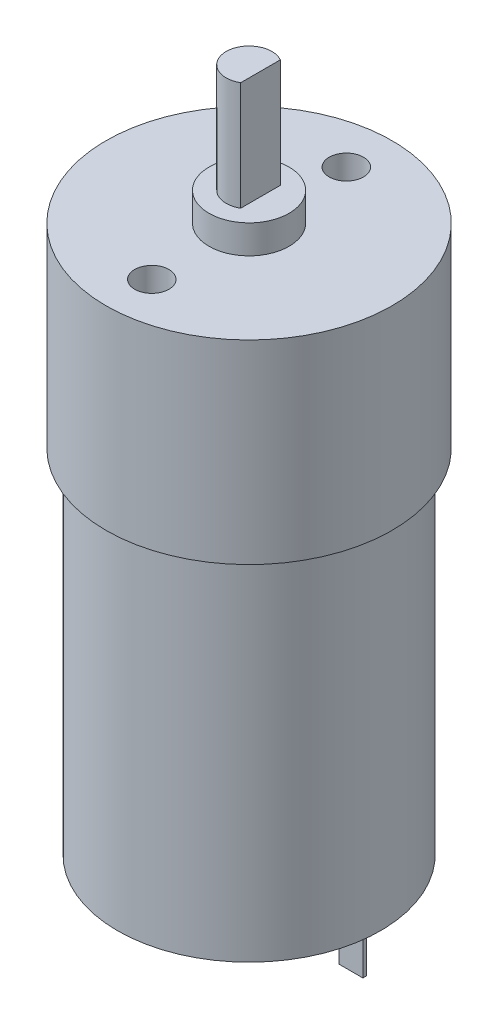
from build123d import *

# Parameters (mm, degrees)
SKETCH2_R           = 12.5
SKETCH2_R_2         = 2
SKETCH2_R_3         = 3.5
BOSS_EXTRUDE1_DEPTH = 17
SKETCH2_3_R         = 2
BOSS_EXTRUDE2_DEPTH = 12
SKETCH2_4_R         = 3.5
SKETCH2_4_R_2       = 2
BOSS_EXTRUDE3_DEPTH = 2.5
SKETCH4_R           = 11.5
BOSS_EXTRUDE4_DEPTH = 30.8
SKETCH5_W           = 2.1
SKETCH5_H           = 0.3
BOSS_EXTRUDE5_DEPTH = 4.2
SKETCH6_R           = 1.5
CUT_EXTRUDE1_DEPTH  = 5
CUT_EXTRUDE2_START  = -9.5
CUT_EXTRUDE2_DEPTH  = 9.5


with BuildPart() as part:
    # Sketch2 → Boss-Extrude1 (new body)
    # profile 1 of 3: a face of its own
    with BuildSketch(Plane(origin=(0, 0, 0), x_dir=(1, 0, 0), z_dir=(0, 1, 0))):
        with Locations(Location((0, 0, 0), (0, 0, 270))):
            Circle(SKETCH2_R)
        Circle(SKETCH2_R_2, mode=Mode.SUBTRACT)
    # profile 2 of 3: a face of its own
    with BuildSketch(Plane(origin=(0, 0, 0), x_dir=(1, 0, 0), z_dir=(0, 1, 0))):
        Circle(SKETCH2_R_3)
        Circle(SKETCH2_R_2, mode=Mode.SUBTRACT)
    # profile 3 of 3: a face of its own
    with BuildSketch(Plane(origin=(0, 0, 0), x_dir=(1, 0, 0), z_dir=(0, 1, 0))):
        Circle(SKETCH2_R_2)
    extrude(amount=-BOSS_EXTRUDE1_DEPTH)

    # Sketch2<3> → Boss-Extrude2 (add)
    with BuildSketch(Plane(origin=(0, 0, 0), x_dir=(1, 0, 0), z_dir=(0, 1, 0))):
        with Locations(Location((0, 0, 0), (0, 0, 270))):
            Circle(SKETCH2_3_R)
    extrude(amount=BOSS_EXTRUDE2_DEPTH)

    # Sketch2<4> → Boss-Extrude3 (add)
    with BuildSketch(Plane(origin=(0, 0, 0), x_dir=(1, 0, 0), z_dir=(0, 1, 0))):
        with Locations(Location((0, 0, 0), (0, 0, 270))):
            Circle(SKETCH2_4_R)
        with Locations(Location((0, 0, 0), (0, 0, 270))):
            Circle(SKETCH2_4_R_2, mode=Mode.SUBTRACT)
    extrude(amount=BOSS_EXTRUDE3_DEPTH)

    # Sketch4 → Boss-Extrude4 (add)
    with BuildSketch(Plane.XZ.offset(17)):
        with Locations(Location((0, 0, 0), (0, 0, 90))):
            Circle(SKETCH4_R)
    extrude(amount=BOSS_EXTRUDE4_DEPTH)

    # Sketch5 → Boss-Extrude5 (add)
    with BuildSketch(Plane.XZ.offset(47.8)):
        with Locations((-9.05, 0)):
            Rectangle(SKETCH5_W, SKETCH5_H)
        with Locations((9.05, 0)):
            Rectangle(SKETCH5_W, SKETCH5_H)
    extrude(amount=BOSS_EXTRUDE5_DEPTH)

    # Sketch6 → Cut-Extrude1 (cut)
    with BuildSketch(Plane(origin=(0, 0, 0), x_dir=(1, 0, 0), z_dir=(0, 1, 0))):
        with Locations(Location((0, -8.5, 0), (0, 0, 270))):
            Circle(SKETCH6_R)
        with Locations(Location((0, 8.5, 0), (0, 0, 90))):
            Circle(SKETCH6_R)
    extrude(amount=-CUT_EXTRUDE1_DEPTH, mode=Mode.SUBTRACT)

    # Sketch7 → Cut-Extrude2 (cut)
    with BuildSketch(Plane(origin=(0, 12, 0), x_dir=(1, 0, 0), z_dir=(0, 1, 0)).offset(CUT_EXTRUDE2_START)):
        with BuildLine():
            ThreePointArc((1, -1.732050808), (2, 0), (1, 1.732050808))
            Line((1, 1.732050808), (1, -1.732050808))
        make_face()
    extrude(amount=CUT_EXTRUDE2_DEPTH, mode=Mode.SUBTRACT)


solid = part.part
